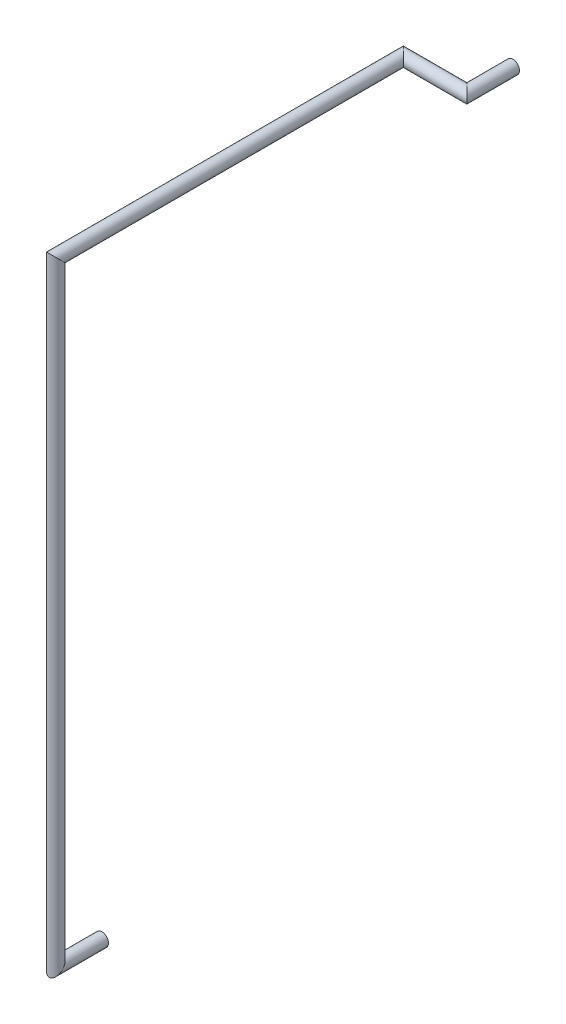
from build123d import *

# Parameters (mm, degrees)
ESQUISSE2_R = 0.5


with BuildPart() as part:
    # Balayage2: sweep along a curve in space
    with BuildLine() as balayage2_path:
        Line((0, 0, 0), (0, 0, 3.5))
        Line((0, 0, 3.5), (0, 46.6, 3.5))
        Line((0, 46.6, 3.5), (0, 46.6, -22.89))
        Line((0, 46.6, -22.89), (4.82, 46.6, -22.89))
        Line((4.82, 46.6, -22.89), (4.82, 46.6, -26.39))
    # Esquisse2 → Balayage2 (sweep)
    with BuildSketch(Plane.XY):
        Circle(ESQUISSE2_R)
    sweep(path=balayage2_path.line, transition=Transition.RIGHT)


solid = part.part
